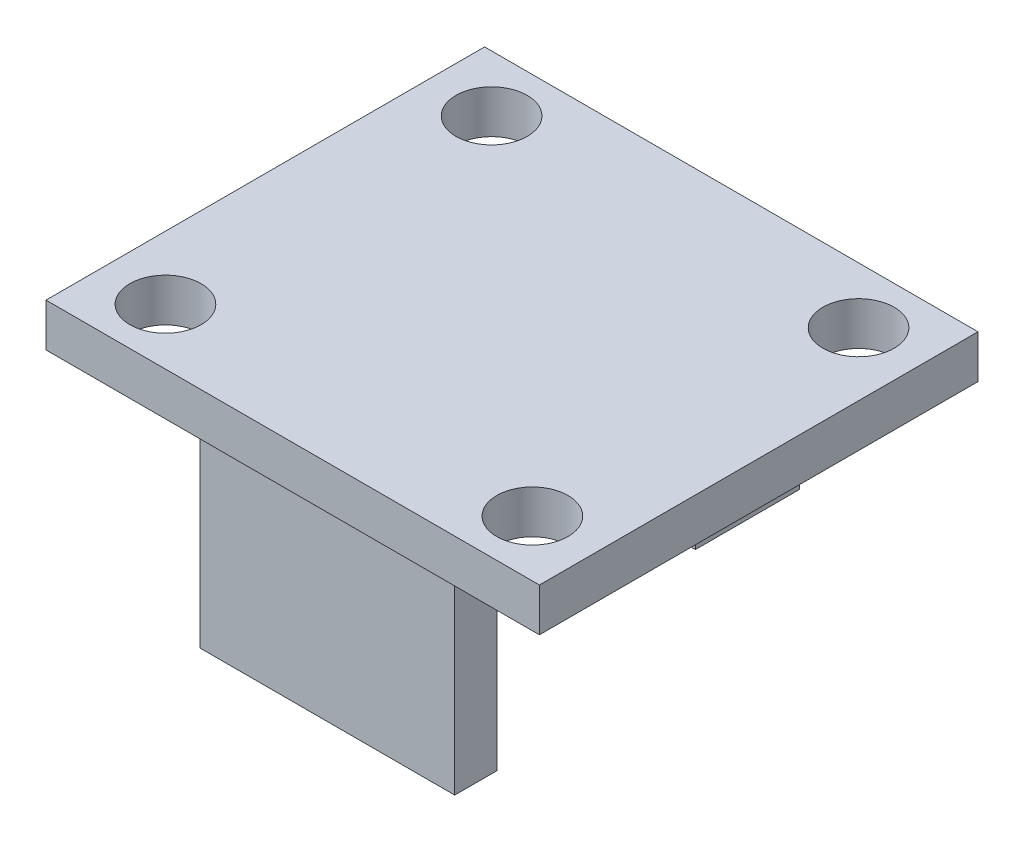
from build123d import *

# Parameters (mm, degrees)
SKETCH1_W           = 22.86
SKETCH1_H           = 20.32
SKETCH1_R           = 1.65
BOSS_EXTRUDE1_DEPTH = 2
SKETCH2_W           = 11.796284554
SKETCH2_H           = 1.966047426
BOSS_EXTRUDE2_DEPTH = 10
SKETCH3_W           = 7.246289084
SKETCH3_H           = 4.830859388
BOSS_EXTRUDE3_DEPTH = 8


with BuildPart() as part:
    # Sketch1 → Boss-Extrude1 (new body)
    with BuildSketch(Plane(origin=(0, 0, 0), x_dir=(1, 0, 0), z_dir=(0, 1, 0))):
        Rectangle(SKETCH1_W, SKETCH1_H)
        with Locations(Location((-8.5, 7.555555556, 0), (0, 0, 270))):
            Circle(SKETCH1_R, mode=Mode.SUBTRACT)
        with Locations(Location((8.5, 7.555555556, 0), (0, 0, 270))):
            Circle(SKETCH1_R, mode=Mode.SUBTRACT)
        with Locations(Location((-8.5, -7.555555556, 0), (0, 0, 270))):
            Circle(SKETCH1_R, mode=Mode.SUBTRACT)
        with Locations(Location((8.5, -7.555555556, 0), (0, 0, 270))):
            Circle(SKETCH1_R, mode=Mode.SUBTRACT)
    extrude(amount=BOSS_EXTRUDE1_DEPTH)

    # Sketch2 → Boss-Extrude2 (add)
    with BuildSketch(Plane.XZ):
        with Locations((0, 7.569282589)):
            Rectangle(SKETCH2_W, SKETCH2_H)
    extrude(amount=BOSS_EXTRUDE2_DEPTH)

    # Sketch3 → Boss-Extrude3 (add)
    with BuildSketch(Plane.XZ):
        with Locations((0, -7.288418671)):
            Rectangle(SKETCH3_W, SKETCH3_H)
    extrude(amount=BOSS_EXTRUDE3_DEPTH)


solid = part.part
